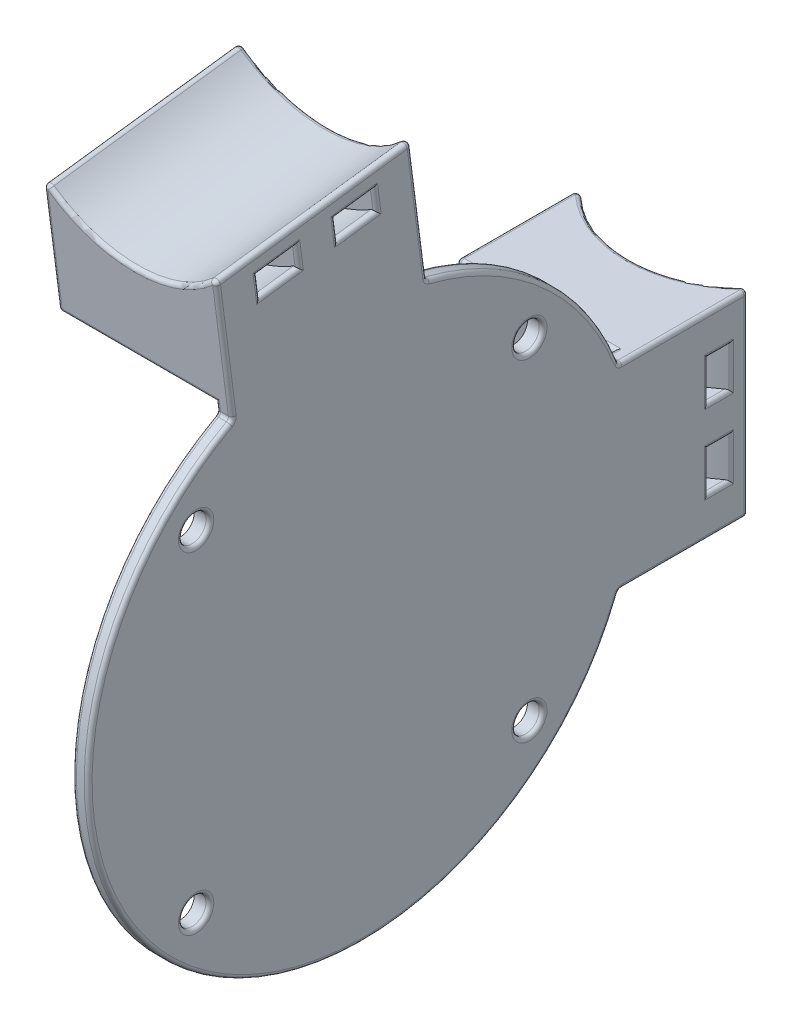
from build123d import *

# Parameters (mm, degrees)
SKETCH1_R               = 4.9999999999999964
SKETCH1_R_2             = 35.00000000000001
SKETCH1_R_3             = 4.999999999999999
BOSS_EXTRUDE1_DEPTH     = 2
SKETCH2_R               = 1.7500000000000004
CUT_EXTRUDE1_DEPTH      = 57.60388679233962
BOSS_EXTRUDE2_DEPTH     = 2
SKETCH5_W               = 29.999999999975532
SKETCH5_H               = 25.000000000000004
BOSS_EXTRUDE3_DEPTH     = 20
CUT_EXTRUDE2_DEPTH      = 80.76627526264193
CUT_EXTRUDE2_DEPTH_BACK = 80.76627526264193
SKETCH7_R               = 15.000000000000002
CUT_EXTRUDE3_DEPTH      = 79.65966658759531
CUT_EXTRUDE3_DEPTH_BACK = 79.65966658759531
SKETCH8_R               = 15.000000000000002
SKETCH11_W              = 2
SKETCH11_H              = 5
FILLET1_R               = 0.5


with BuildPart() as part:
    # Sketch1 → Boss-Extrude1 (new body)
    with BuildSketch(Plane(origin=(0, 0, 0), x_dir=(0, 0, -1), z_dir=(1, 0, 0))):
        with Locations((35, 0)):
            Circle(SKETCH1_R)
        Circle(SKETCH1_R_2)
        with Locations((0, 35)):
            Circle(SKETCH1_R_3)
    extrude(amount=BOSS_EXTRUDE1_DEPTH)

    # Sketch2 → Cut-Extrude1 (cut, through all)
    with BuildSketch(Plane(origin=(2, 0, 0), x_dir=(0, 0, -1), z_dir=(1, 0, 0))):
        with Locations((-21.236932225738045, 21.125000000000007)):
            Circle(SKETCH2_R)
        with Locations((21.236932225738066, -21.124999999999996)):
            Circle(SKETCH2_R)
        with Locations((21.23693222573806, 21.12500000000001)):
            Circle(SKETCH2_R)
        with Locations((-21.236932225738038, -21.124999999999996)):
            Circle(SKETCH2_R)
    extrude(amount=-CUT_EXTRUDE1_DEPTH, mode=Mode.SUBTRACT)

    # Sketch4 → Boss-Extrude2 (add)
    with BuildSketch(Plane(origin=(0, 0, 0), x_dir=(0, 0, -1), z_dir=(1, 0, 0))):
        Polygon((0, 1.78e-15), (0, 12.5), (10.988671404866835, 12.5), (4.707615651168194, 61.10718742406822), (-20.086237534059137, 57.903307865135645), (-12.396926592626029, -1.6019397794678851), align=None)
        Polygon((59.999999999975536, 12.5), (10.988671404866835, 12.5), (12.396926592626029, 1.601939779467891), (-1.78e-15, 2e-15), (0, -12.5), (59.999999999975536, -12.5), align=None)
    extrude(amount=BOSS_EXTRUDE2_DEPTH)

    # Sketch5 → Boss-Extrude3 (add)
    with BuildSketch(Plane.ZY):
        with Locations((-44.99999999998778, 0)):
            Rectangle(SKETCH5_W, SKETCH5_H)
        Polygon((-4.707615651168194, 61.10718742406823), (-8.55227112189659, 31.354563601772135), (16.24158206334142, 28.150684042832943), (20.086237534059137, 57.903307865135645), align=None)
    extrude(amount=BOSS_EXTRUDE3_DEPTH)

    # Sketch7 → Cut-Extrude2 (cut, two sides: drawn at the far end of the back side and taken through both)
    with BuildSketch(Plane(origin=(0, 12.5, 0), x_dir=(1, 0, 0), z_dir=(0, 1, 0)).offset(-CUT_EXTRUDE2_DEPTH_BACK)):
        with Locations((-9, 59.999999999975536)):
            Circle(SKETCH7_R)
    extrude(amount=CUT_EXTRUDE2_DEPTH + CUT_EXTRUDE2_DEPTH_BACK, mode=Mode.SUBTRACT)

    # Sketch8 → Cut-Extrude3 (cut, two sides: drawn at the far end of the back side and taken through both)
    with BuildSketch(Plane(origin=(0, 1.6019397794704646, -12.396926592625704), x_dir=(-1, 0, 0), z_dir=(0, 0.12815518235763712, -0.9917541274100558)).offset(-CUT_EXTRUDE3_DEPTH_BACK)):
        with Locations((9, 59.9999999999944)):
            Circle(SKETCH8_R)
    extrude(amount=CUT_EXTRUDE3_DEPTH + CUT_EXTRUDE3_DEPTH_BACK, mode=Mode.SUBTRACT)

    # Sketch9 → Cut-Revolve1 (revolve, cut)
    with BuildSketch(Plane(origin=(0, 0, 0), x_dir=(1, 0, 0), z_dir=(0, 1, 0))):
        Polygon((0, 0), (-2.430423e-11, 36), (-20, 36), (-20, 0), align=None)
    revolve(axis=Axis((-34.91533073903674, 0, 0), (1, 0, 0)), mode=Mode.SUBTRACT)

    # Sketch11 → Cut-Revolve2 (revolve, cut)
    with BuildSketch(Plane(origin=(-8.999999999999998, 0, 0), x_dir=(0, 0, -1), z_dir=(1, 0, 0))):
        Polygon((42.999999999969155, 7.499999999999998), (40.999999999969155, 7.499999999999998), (40.999999999969155, 2.499999999999998), (42.99999999996915, 2.499999999999998), align=None)
        with Locations((41.999999999969155, -5.000000000000002)):
            Rectangle(SKETCH11_W, SKETCH11_H)
    revolve(axis=Axis((-8.999999999999998, 45.94720044365849, -59.999999999975536), (0, -1, -1.4e-16)), mode=Mode.SUBTRACT)

    # Sketch12 → Cut-Revolve3 (revolve, cut)
    with BuildSketch(Plane(origin=(-8.999999999999998, 0, 0), x_dir=(0, 0, -1), z_dir=(1, 0, 0))):
        Polygon((-12.948828796940836, 41.68426361094668), (-12.692518432226317, 39.70075535612647), (-7.733747795175791, 40.341531267912764), (-7.990058159890312, 42.32503952273298), align=None)
        Polygon((-3.031287522845764, 42.96581543451851), (-2.774977158131244, 40.982307179698296), (2.1837934789192808, 41.623083091484574), (1.9274831142047593, 43.6065913463048), align=None)
    revolve(axis=Axis((-8.999999999999998, 53.26934074952737, 55.94710502810817), (0, 0.1281551823574304, -0.9917541274100824)), mode=Mode.SUBTRACT)

    # Fillet1
    fillet1_edges = [part.edges().sort_by_distance(p)[0] for p in [
        (-20, -12.5, -41.7810723107894),
        (-20, 0, -49.80196097278996),
        (2, -12.5, -41.246851524672934),
        (-8.999999999999577, 12.5, -44.999999999975536),
        (2, 0, -49.80196097278996),
        (-8.99999999999999, -12.5, -44.999999999975536),
        (-20, 43.0384906913242, -7.042465651537526),
        (-20, 49.391300347899026, 6.382379390227807),
        (2, 42.508675021743464, -7.11092881380171),
        (-8.999999999999996, 43.026995953979686, 18.163909798693915),
        (2, 49.391300347899, 6.382379390227983),
        (-9.00000000000041, 46.23087551291742, -6.629943386532751),
        (-20, 39.834611132387664, 17.7513875336963),
        (-20, 12.5, -41.781072310789355),
        (0, 31.35004602676534, 16.655005922285635),
        (0, -12.5, -33.225962862672745),
        (0, 12.5, -33.22596286267254),
        (0, 34.55392558569893, -8.13884726295186),
        (-20, -3.55e-15, -36),
        (-10.000000000012154, 35.08374125527901, -8.070384100687754),
        (-10.000000000012154, 31.879861696345486, 16.723469084549542),
        (-10.000000000012154, -12.5, -33.76018364878959),
        (-10.000000000012154, 12.5, -33.76018364878959),
        (-20, 35.703148586762964, 4.613586564867495),
        (-20, -2.5000000000000018, -45.77329260914475),
        (-20, -5.000000000000002, -44.50806661513804),
        (-20, -7.500000000000003, -45.77329260914475),
        (-20, -5.000000000000002, -47.038518603151445),
        (-20, 7.499999999999997, -45.77329260914475),
        (-20, 4.999999999999997, -44.50806661513804),
        (-20, 2.4999999999999982, -45.77329260914474),
        (-20, 4.999999999999998, -47.03851860315144),
        (2, 4.999999999999998, -47.03851860315143),
        (2, 2.499999999999998, -45.77329260914474),
        (2, 4.999999999999997, -44.50806661513804),
        (2, 7.499999999999998, -45.77329260914475),
        (2, -5.000000000000002, -47.038518603151445),
        (2, -7.500000000000002, -45.77329260914475),
        (2, -5.000000000000002, -44.50806661513804),
        (2, -2.500000000000002, -45.77329260914475),
        (-20, 45.71623982618232, 3.386699342904916),
        (-20, 44.78183468041349, 0.7451687563947962),
        (-20, 46.357015737968325, -1.5720712941453048),
        (-20, 47.291420883737125, 1.0694592923648116),
        (-20, 44.43468800261095, 13.30424061700005),
        (-20, 43.50028285684205, 10.662710030489912),
        (-20, 45.07546391439697, 8.345469979949822),
        (-20, 46.00986906016583, 10.987000566459951),
        (2, 46.009869060165826, 10.987000566459951),
        (2.000000000000001, 45.07546391439698, 8.345469979949824),
        (2, 43.50028285684205, 10.662710030489912),
        (2.000000000000001, 44.434688002610955, 13.304240617000055),
        (2, 47.291420883737125, 1.0694592923648116),
        (2.000000000000001, 46.357015737968325, -1.5720712941453021),
        (2, 44.78183468041348, 0.7451687563947957),
        (2.000000000000001, 45.716239826182324, 3.3866993429049206),
        (2, -21.124999999999996, 22.986932225738038),
        (2, 21.12500000000001, -19.48693222573806),
        (2, -21.124999999999996, -19.486932225738066),
        (2, 21.125000000000007, 22.986932225738045),
        (0, -26.286784687249572, 23.10854713750265),
        (2, -26.286784687249572, 23.10854713750265),
        (2, 39.30479546280745, 17.682924371433035),
        (1, 34.02410991611893, -8.207310425215951),
        (1, 30.82023035718489, 16.58654276002264),
        (0, 26.286784687253764, -23.108547137497883),
        (2, 26.286784687253764, -23.108547137497883),
        (2, 12.5, -41.24685152467308),
        (1, -12.5, -32.69174207655506),
        (1, 12.5, -32.69174207655506),
    ]]
    fillet(fillet1_edges, radius=FILLET1_R)


solid = part.part
